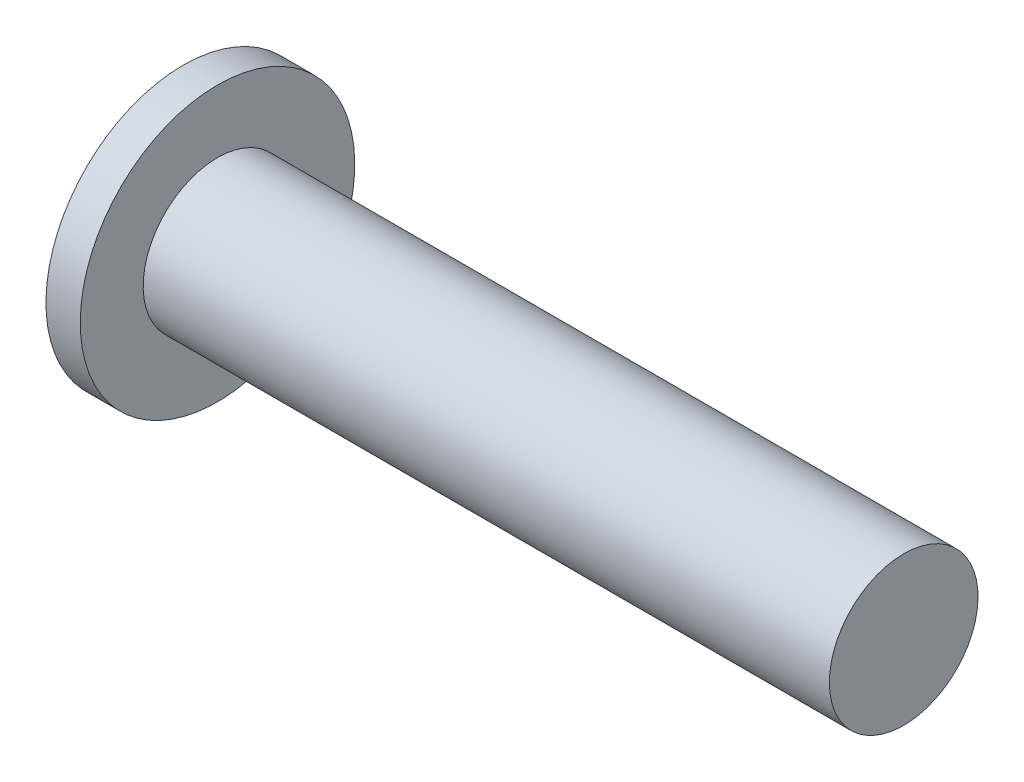
from build123d import *


with BuildPart() as part:
    # Croquis1 → Revolución1 (revolve)
    with BuildSketch(Plane.XY):
        Polygon((0, 0), (0, 6), (1.5, 6), (1.5, 3.25), (31.5, 3.25), (31.5, 0), align=None)
    revolve(axis=Axis((31.5, 0, 0), (-1, 0, 0)))


solid = part.part
